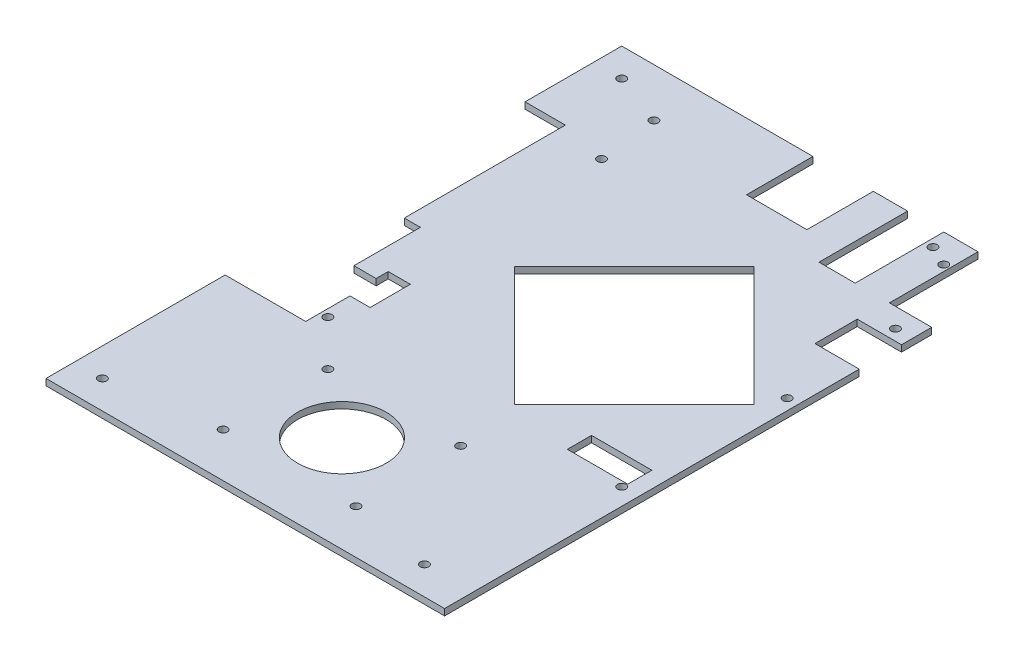
from build123d import *

# Parameters (mm, degrees)
SKETCH_1_R      = 1.05
SKETCH_1_W      = 15
SKETCH_1_H      = 6
SKETCH_1_R_2    = 11
EXTRUDE_1_DEPTH = 1.6


with BuildPart() as part:
    # 草图1 → 凸台-拉伸1 (new body)
    with BuildSketch(Plane(origin=(0, 0, 0), x_dir=(1, 0, 0), z_dir=(0, 1, 0))):
        Polygon((47.5, 0), (0, 0), (0, -24), (10, -24), (10, -64), (14, -64), (14, -80.5), (19.5, -80.5), (19.5, -77.5), (25, -77.5), (25, -87.5), (20, -87.5), (20, -98.5), (0, -98.5), (0, -143), (99, -143), (99, -40), (88, -40), (88, -29.5), (99, -29.5), (99, -22), (88.5, -22), (88.5, 0), (80, 0), (80, -22), (71, -22), (71, 0), (62.5, 0), (62.5, -16.5), (47.5, -16.5), align=None)
        with Locations(Location((21.8, -94.8, 0), (0, 0, 270))):
            Circle(SKETCH_1_R, mode=Mode.SUBTRACT)
        with Locations((87.5, -90.5)):
            Rectangle(SKETCH_1_W, SKETCH_1_H, mode=Mode.SUBTRACT)
        with Locations(Location((94.8, -94.8, 0), (0, 0, 270))):
            Circle(SKETCH_1_R, mode=Mode.SUBTRACT)
        with Locations(Location((21.8, -26.8, 0), (0, 0, 270))):
            Circle(SKETCH_1_R, mode=Mode.SUBTRACT)
        with Locations(Location((7, -7, 0), (0, 0, 270))):
            Circle(SKETCH_1_R, mode=Mode.SUBTRACT)
        with Locations(Location((20, -12, 0), (0, 0, 270))):
            Circle(SKETCH_1_R, mode=Mode.SUBTRACT)
        Polygon((34.10303038, -60.69848481), (63.80151519, -31), (93.5, -60.69848481), (63.80151519, -90.39696962), align=None, mode=Mode.SUBTRACT)
        with Locations(Location((96.3, -55.2, 0), (0, 0, 270))):
            Circle(SKETCH_1_R, mode=Mode.SUBTRACT)
        with Locations(Location((94.8, -26.8, 0), (0, 0, 270))):
            Circle(SKETCH_1_R, mode=Mode.SUBTRACT)
        with Locations(Location((81.9, -4.6, 0), (0, 0, 270))):
            Circle(SKETCH_1_R, mode=Mode.SUBTRACT)
        with Locations(Location((87, -7, 0), (0, 0, 270))):
            Circle(SKETCH_1_R, mode=Mode.SUBTRACT)
        with Locations(Location((66, -106, 0), (0, 0, 270))):
            Circle(SKETCH_1_R, mode=Mode.SUBTRACT)
        with Locations(Location((7, -136, 0), (0, 0, 270))):
            Circle(SKETCH_1_R, mode=Mode.SUBTRACT)
        with Locations(Location((33, -132, 0), (0, 0, 270))):
            Circle(SKETCH_1_R, mode=Mode.SUBTRACT)
        with Locations(Location((33, -106, 0), (0, 0, 270))):
            Circle(SKETCH_1_R, mode=Mode.SUBTRACT)
        with Locations(Location((66, -132, 0), (0, 0, 270))):
            Circle(SKETCH_1_R, mode=Mode.SUBTRACT)
        with Locations(Location((49.5, -119, 0), (0, 0, 270))):
            Circle(SKETCH_1_R_2, mode=Mode.SUBTRACT)
        with Locations(Location((87, -136, 0), (0, 0, 270))):
            Circle(SKETCH_1_R, mode=Mode.SUBTRACT)
    extrude(amount=EXTRUDE_1_DEPTH)


solid = part.part
